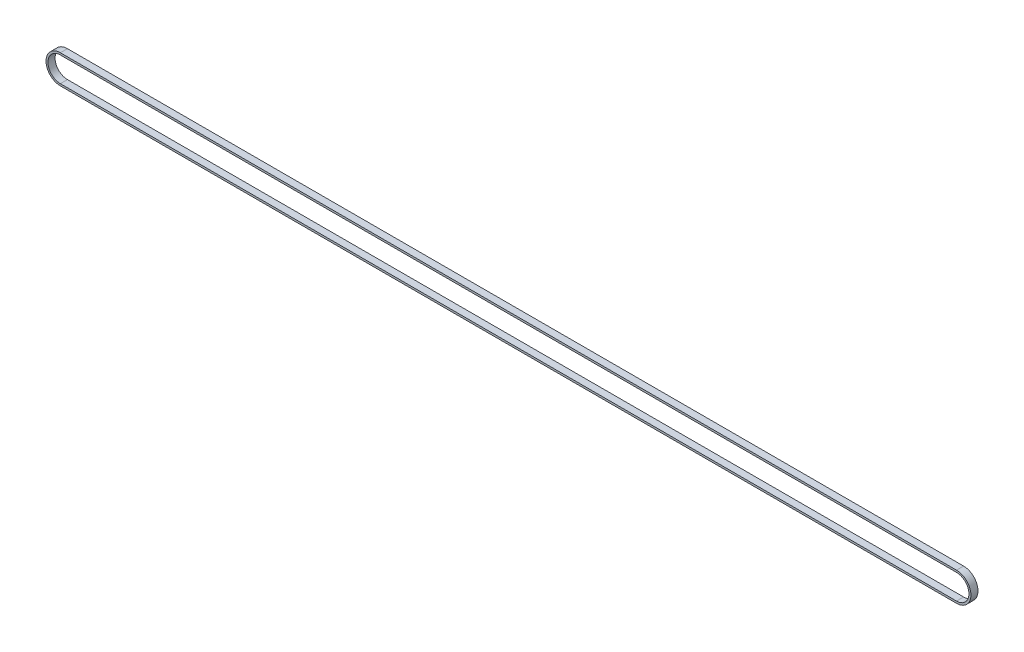
from build123d import *

# Parameters (mm, degrees)
EXTRUDE_THIN1_DEPTH = 2.5


with BuildPart() as part:
    # Sketch1 → Extrude-Thin1 (new, symmetric)
    with BuildSketch(Plane.XY):
        with BuildLine():
            Line((632, -10.13), (0, -10.13))
            ThreePointArc((0, -10.13), (-10.13, 0), (0, 10.13))
            Line((0, 10.13), (632, 10.13))
            ThreePointArc((632, 10.13), (642.13, 0), (632, -10.13))
        make_face()
        with BuildLine():
            Line((632, -8.75), (0, -8.75))
            ThreePointArc((0, -8.75), (-8.75, 0), (0, 8.75))
            Line((0, 8.75), (632, 8.75))
            ThreePointArc((632, 8.75), (640.75, 0), (632, -8.75))
        make_face(mode=Mode.SUBTRACT)
    extrude(amount=EXTRUDE_THIN1_DEPTH, both=True)


solid = part.part
